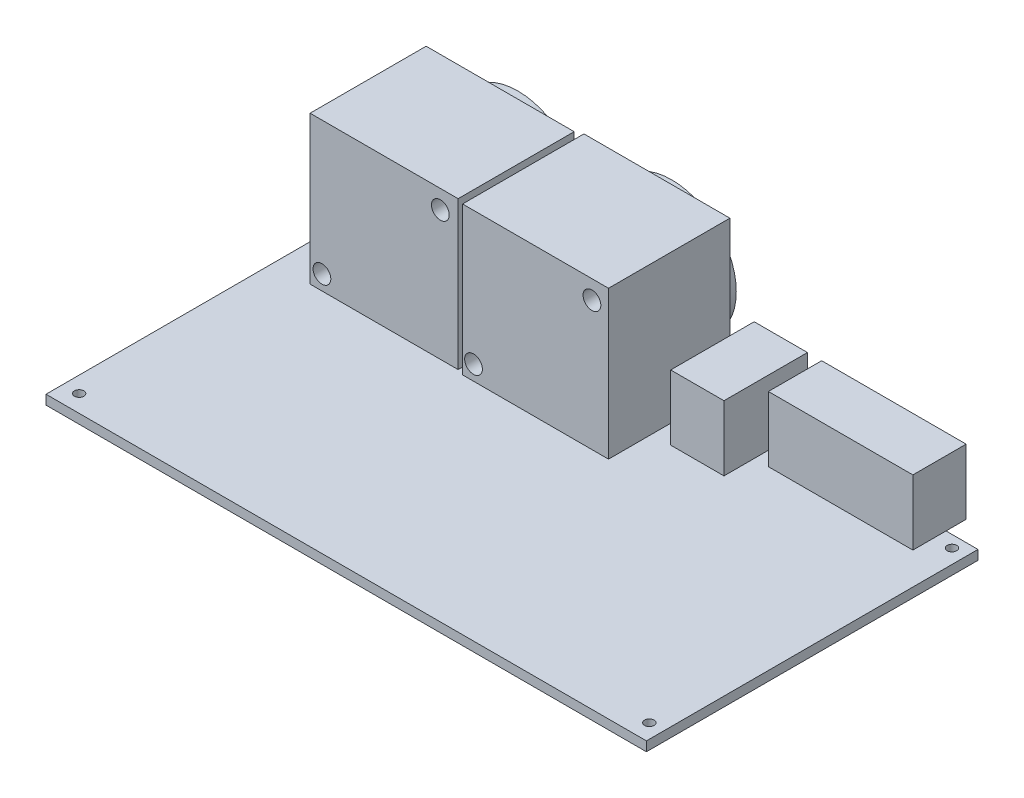
from build123d import *

# Parameters (mm, degrees)
SKETCH1_W           = 101.4
SKETCH1_H           = 56
SKETCH1_R           = 0.8
BOSS_EXTRUDE1_DEPTH = 1.6
SKETCH2_W           = 25
SKETCH2_H           = 19.6
SKETCH2_W_2         = 24.65
SKETCH2_H_2         = 20.5
BOSS_EXTRUDE2_DEPTH = 25
SKETCH3_R           = 1.5
CUT_EXTRUDE1_DEPTH  = 121.04903165
SKETCH4_R           = 10.9
BOSS_EXTRUDE3_DEPTH = 3
SKETCH5_W           = 9
SKETCH5_H           = 14.1
SKETCH5_W_2         = 24.4
SKETCH5_H_2         = 9
BOSS_EXTRUDE4_DEPTH = 11


with BuildPart() as part:
    # Sketch1 → Boss-Extrude1 (new body)
    with BuildSketch(Plane(origin=(0, 0, 0), x_dir=(1, 0, 0), z_dir=(0, 1, 0))):
        with Locations((50.7, 28)):
            Rectangle(SKETCH1_W, SKETCH1_H)
        with Locations(Location((2.7, 54, 0), (0, 0, 270))):
            Circle(SKETCH1_R, mode=Mode.SUBTRACT)
        with Locations(Location((2.7, 2.9, 0), (0, 0, 270))):
            Circle(SKETCH1_R, mode=Mode.SUBTRACT)
        with Locations(Location((99, 2.9, 0), (0, 0, 270))):
            Circle(SKETCH1_R, mode=Mode.SUBTRACT)
        with Locations(Location((99, 54, 0), (0, 0, 270))):
            Circle(SKETCH1_R, mode=Mode.SUBTRACT)
    extrude(amount=BOSS_EXTRUDE1_DEPTH)

    # Sketch2 → Boss-Extrude2 (add)
    with BuildSketch(Plane(origin=(0, 1.6, 0), x_dir=(1, 0, 0), z_dir=(0, 1, 0))):
        with Locations((18.7, 48.2)):
            Rectangle(SKETCH2_W, SKETCH2_H)
        with Locations((44.675, 48.25)):
            Rectangle(SKETCH2_W_2, SKETCH2_H_2)
    extrude(amount=BOSS_EXTRUDE2_DEPTH)

    # Sketch3 → Cut-Extrude1 (cut, through all)
    with BuildSketch(Plane(origin=(0, 0, -58.5), x_dir=(-1, 0, 0), z_dir=(0, 0, -1))):
        with Locations((-54.2, 23.45)):
            Circle(SKETCH3_R)
        with Locations((-34.2, 4.1)):
            Circle(SKETCH3_R)
        with Locations((-28.2, 23.45)):
            Circle(SKETCH3_R)
        with Locations((-8.2, 4.1)):
            Circle(SKETCH3_R)
    extrude(amount=-CUT_EXTRUDE1_DEPTH, mode=Mode.SUBTRACT)

    # Sketch4 → Boss-Extrude3 (add)
    with BuildSketch(Plane(origin=(0, 0, -58), x_dir=(-1, 0, 0), z_dir=(0, 0, -1))):
        with Locations(Location((-18.7, 13.9, 0), (0, 0, 180))):
            Circle(SKETCH4_R)
        with Locations(Location((-44.675, 13.9, 0), (0, 0, 180))):
            Circle(SKETCH4_R)
    extrude(amount=BOSS_EXTRUDE3_DEPTH)

    # Sketch5 → Boss-Extrude4 (add)
    with BuildSketch(Plane(origin=(0, 1.6, 0), x_dir=(1, 0, 0), z_dir=(0, 1, 0))):
        with Locations((64.7, 52.35)):
            Rectangle(SKETCH5_W, SKETCH5_H)
        with Locations((83.8, 54.9)):
            Rectangle(SKETCH5_W_2, SKETCH5_H_2)
    extrude(amount=BOSS_EXTRUDE4_DEPTH)


solid = part.part
